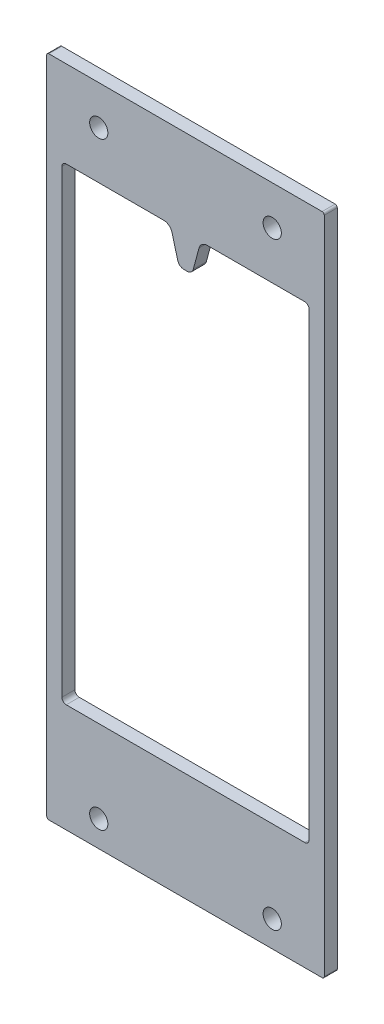
from build123d import *

# Parameters (mm, degrees)
SKETCH1_W           = 64
SKETCH1_H           = 153
SKETCH1_R           = 2.1
BOSS_EXTRUDE1_DEPTH = 3
FILLET2_R           = 0.5
FILLET3_R           = 1


with BuildPart() as part:
    # Sketch1 → Boss-Extrude1 (new body)
    with BuildSketch(Plane.XY):
        with Locations((28.5, -56.5)):
            Rectangle(SKETCH1_W, SKETCH1_H)
        with Locations((8.5, 11)):
            Circle(SKETCH1_R, mode=Mode.SUBTRACT)
        with Locations(Location((48.5, 11, 0), (0, 0, 180))):
            Circle(SKETCH1_R, mode=Mode.SUBTRACT)
        with Locations((48.5, -127)):
            Circle(SKETCH1_R, mode=Mode.SUBTRACT)
        with Locations(Location((8.5, -127, 0), (0, 0, 180))):
            Circle(SKETCH1_R, mode=Mode.SUBTRACT)
        with BuildLine():
            Line((0, 0), (23.455727081, 0))
            ThreePointArc((23.455727081, 0), (24.673249939, -0.413293319), (25.387578733, -1.48236191))
            Line((25.387578733, -1.48236191), (26.702101743, -6.388228568))
            ThreePointArc((26.702101743, -6.388228568), (27.237848338, -7.19003001), (28.150990482, -7.5))
            Line((28.150990482, -7.5), (28.849009518, -7.5))
            ThreePointArc((28.849009518, -7.5), (29.762151662, -7.19003001), (30.297898257, -6.388228568))
            Line((30.297898257, -6.388228568), (31.612421267, -1.48236191))
            ThreePointArc((31.612421267, -1.48236191), (32.326750061, -0.413293319), (33.544272919, 0))
            Line((33.544272919, 0), (57, 0))
            Line((57, 0), (57, -108))
            Line((57, -108), (0, -108))
            Line((0, -108), (0, 0))
        make_face(mode=Mode.SUBTRACT)
    extrude(amount=BOSS_EXTRUDE1_DEPTH)

    # Fillet2
    fillet2_edges = [part.edges().sort_by_distance(p)[0] for p in [
        (-3.5, 20, 1.5),
        (60.5, 20, 1.5),
        (60.5, -133, 1.5),
        (-3.5, -133, 1.5),
    ]]
    fillet(fillet2_edges, radius=FILLET2_R)

    # Fillet3
    fillet3_edges = [part.edges().sort_by_distance(p)[0] for p in [
        (0, 0, 1.5),
        (0, -108, 1.5),
        (57, -108, 1.5),
        (57, 0, 1.5),
    ]]
    fillet(fillet3_edges, radius=FILLET3_R)


solid = part.part
